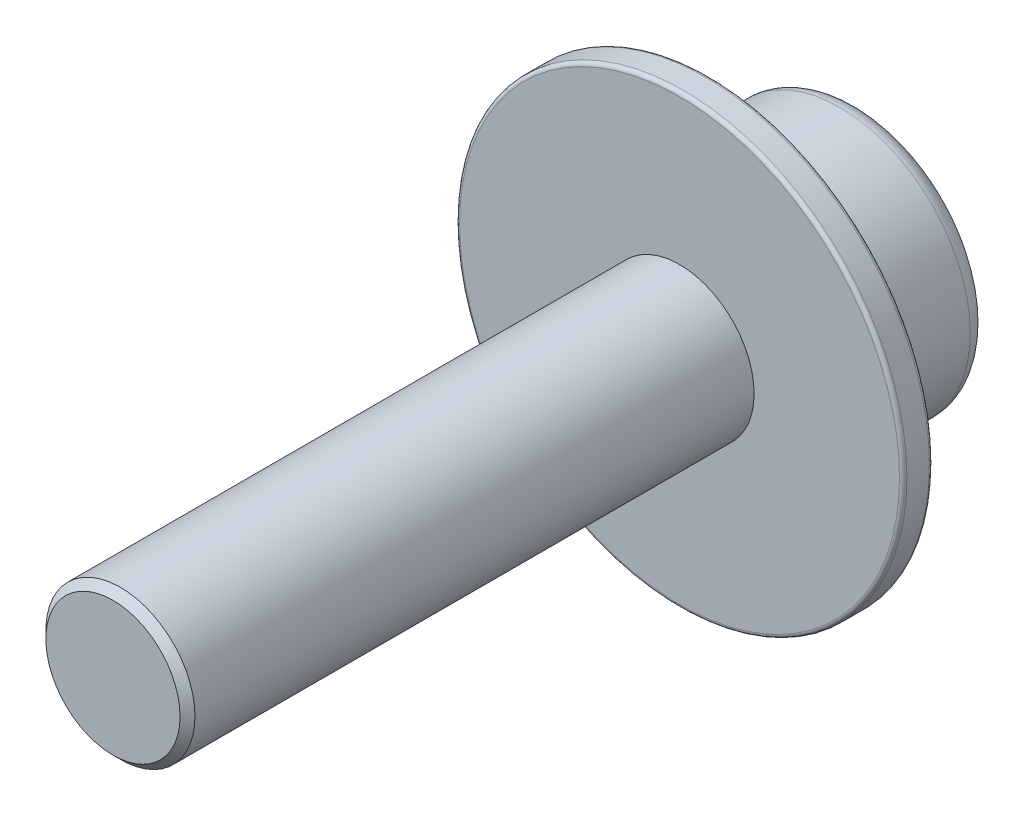
from build123d import *

# Parameters (mm, degrees)
SKETCH1_R           = 3.5
BOSS_EXTRUDE1_DEPTH = 4
SKETCH2_R           = 2
BOSS_EXTRUDE2_DEPTH = 16
CUT_EXTRUDE1_DEPTH  = 2.5
FILLET1_R           = 0.5
CHAMFER1_SIZE       = 0.2
SKETCH4_R           = 6
BOSS_EXTRUDE3_DEPTH = 0.8
FILLET2_R           = 0.1


with BuildPart() as part:
    # Sketch1 → Boss-Extrude1 (new body)
    with BuildSketch(Plane.XY):
        Circle(SKETCH1_R)
    extrude(amount=BOSS_EXTRUDE1_DEPTH)

    # Sketch2 → Boss-Extrude2 (add)
    with BuildSketch(Plane.XY.offset(4)):
        Circle(SKETCH2_R)
    extrude(amount=BOSS_EXTRUDE2_DEPTH)

    # Sketch3 → Cut-Extrude1 (cut)
    with BuildSketch(Plane(origin=(0, 0, 0), x_dir=(-1, 0, 0), z_dir=(0, 0, -1))):
        Polygon((2.020725942, 0), (1.010362971, 1.75), (-1.010362971, 1.75), (-2.020725942, 0), (-1.010362971, -1.75), (1.010362971, -1.75), align=None)
    extrude(amount=-CUT_EXTRUDE1_DEPTH, mode=Mode.SUBTRACT)

    # Fillet1
    fillet1_edges = [part.edges().sort_by_distance(p)[0] for p in [
        (-1.515544457, -0.875, 0),
        (-1.515544457, 0.875, 0),
        (0, 1.75, 0),
        (1.515544457, 0.875, 0),
        (1.515544457, -0.875, 0),
        (0, -1.75, 0),
        (-3.5, 0, 0),
        (-3.5, 0, 4),
        (-2, 0, 4),
    ]]
    fillet(fillet1_edges, radius=FILLET1_R)

    # Chamfer1
    chamfer1_edges = [part.edges().sort_by_distance(p)[0] for p in [
        (-2, 0, 20),
    ]]
    chamfer(chamfer1_edges, length=CHAMFER1_SIZE)

    # Sketch4 → Boss-Extrude3 (add)
    with BuildSketch(Plane.XY.offset(4)):
        Circle(SKETCH4_R)
    extrude(amount=BOSS_EXTRUDE3_DEPTH)

    # Fillet2
    fillet2_edges = [part.edges().sort_by_distance(p)[0] for p in [
        (-6, 0, 4),
        (-6, 0, 4.8),
    ]]
    fillet(fillet2_edges, radius=FILLET2_R)


solid = part.part
